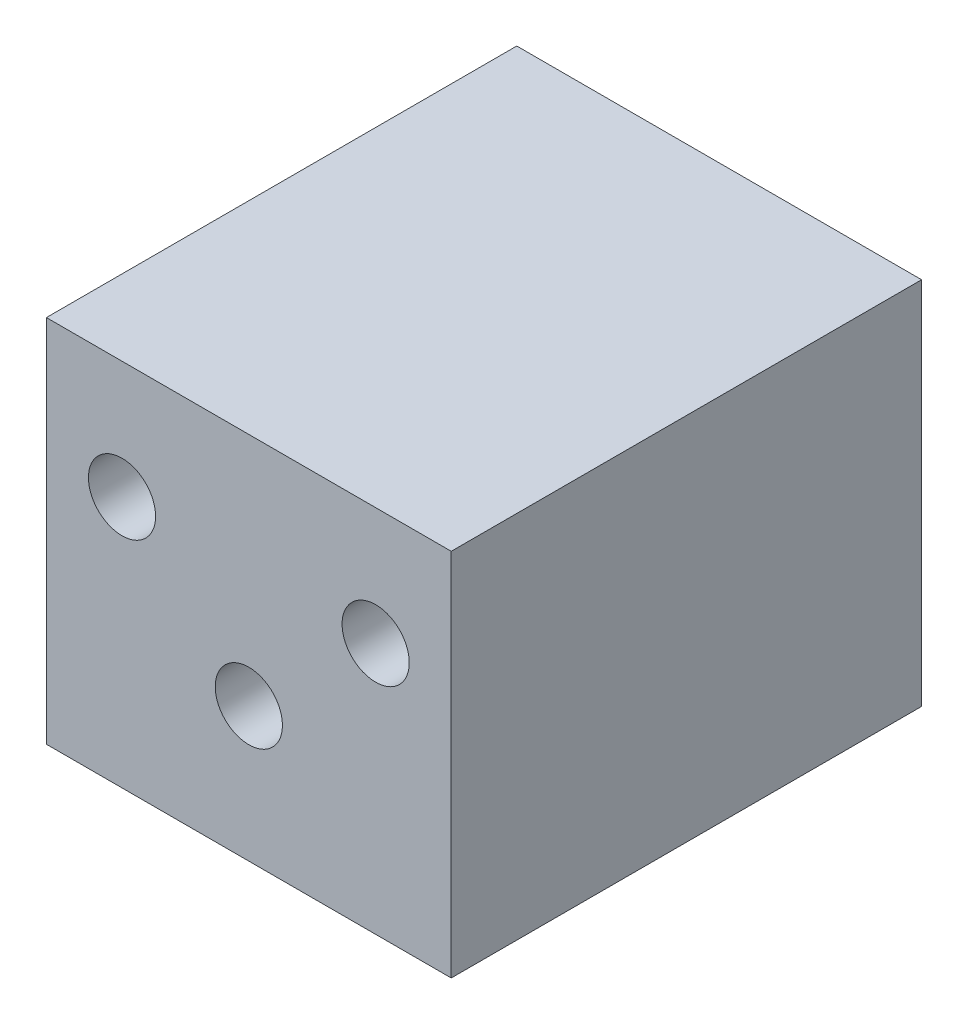
from build123d import *

# Parameters (mm, degrees)
CROQUIS1_W              = 24.1
CROQUIS1_H              = 22
CROQUIS1_R              = 2
SALIENTE_EXTRUIR1_DEPTH = 28
CROQUIS2_R              = 2
CORTAR_EXTRUIR1_DEPTH   = 3


with BuildPart() as part:
    # Croquis1 → Saliente-Extruir1 (new body)
    with BuildSketch(Plane.XY):
        Rectangle(CROQUIS1_W, CROQUIS1_H)
        with Locations((-7.55, 4)):
            Circle(CROQUIS1_R, mode=Mode.SUBTRACT)
        with Locations((7.55, 4)):
            Circle(CROQUIS1_R, mode=Mode.SUBTRACT)
    extrude(amount=SALIENTE_EXTRUIR1_DEPTH)

    # Croquis2 → Cortar-Extruir1 (cut)
    with BuildSketch(Plane.XY.offset(28)):
        with Locations((0, -3)):
            Circle(CROQUIS2_R)
    extrude(amount=-CORTAR_EXTRUIR1_DEPTH, mode=Mode.SUBTRACT)


solid = part.part
